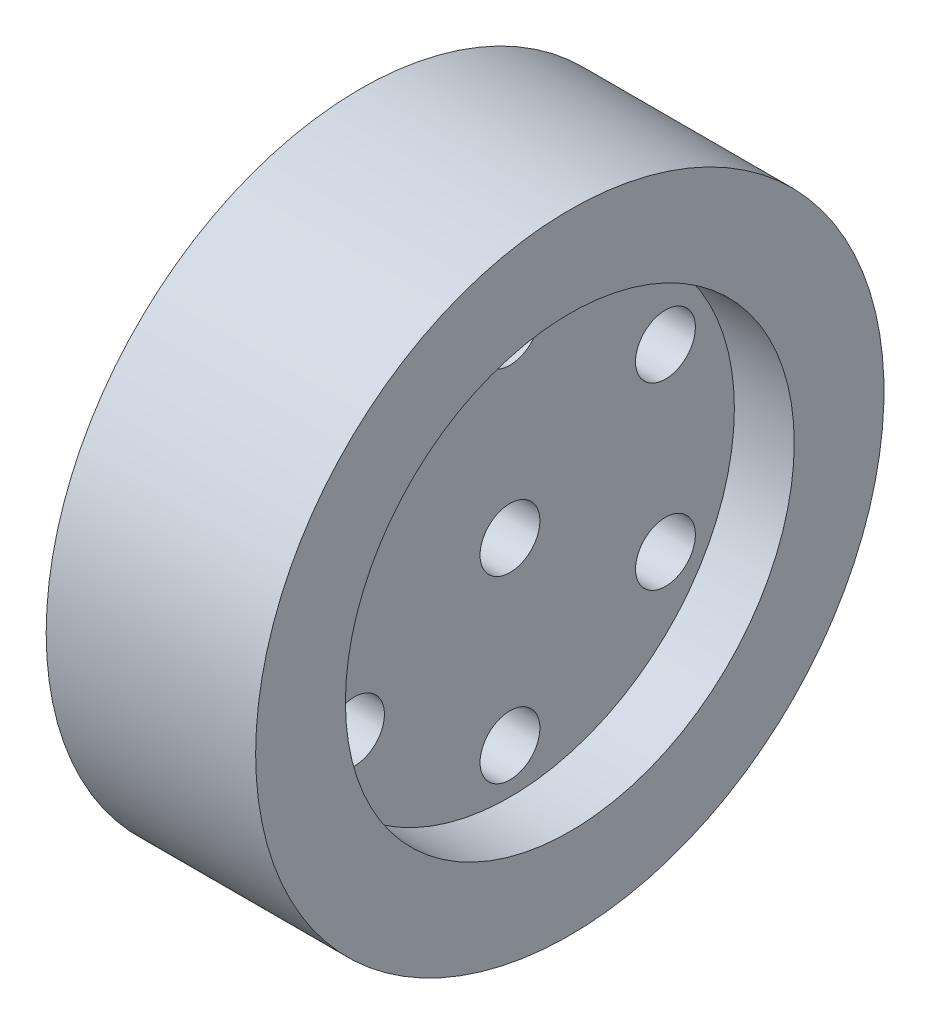
from build123d import *

# Parameters (mm, degrees)
SKETCH2_R          = 2
CUT_EXTRUDE1_DEPTH = 50


with BuildPart() as part:
    # Sketch1 → Revolve1 (revolve)
    with BuildSketch(Plane.XY, mode=Mode.PRIVATE) as revolve1_sk:
        Polygon((0, 2), (10, 2), (10, 15), (14, 15), (14, 21), (0, 21), (0, 19), (4, 19), (4, 5), (0, 5), align=None)
    revolve(revolve1_sk.sketch.rotate(Axis((0, 0, 0), (1, 0, 0)), 90), axis=Axis((0, 0, 0), (1, 0, 0)))

    # Sketch2 → Cut-Extrude1 (cut)
    with BuildSketch(Plane.ZY.offset(-4)):
        with Locations((0, 12)):
            Circle(SKETCH2_R)
        with Locations((10.392304845, 6)):
            Circle(SKETCH2_R)
        with Locations((10.392304845, -6)):
            Circle(SKETCH2_R)
        with Locations((0, -12)):
            Circle(SKETCH2_R)
        with Locations((-10.392304845, -6)):
            Circle(SKETCH2_R)
        with Locations((-10.392304845, 6)):
            Circle(SKETCH2_R)
    extrude(amount=-CUT_EXTRUDE1_DEPTH, mode=Mode.SUBTRACT)


solid = part.part
